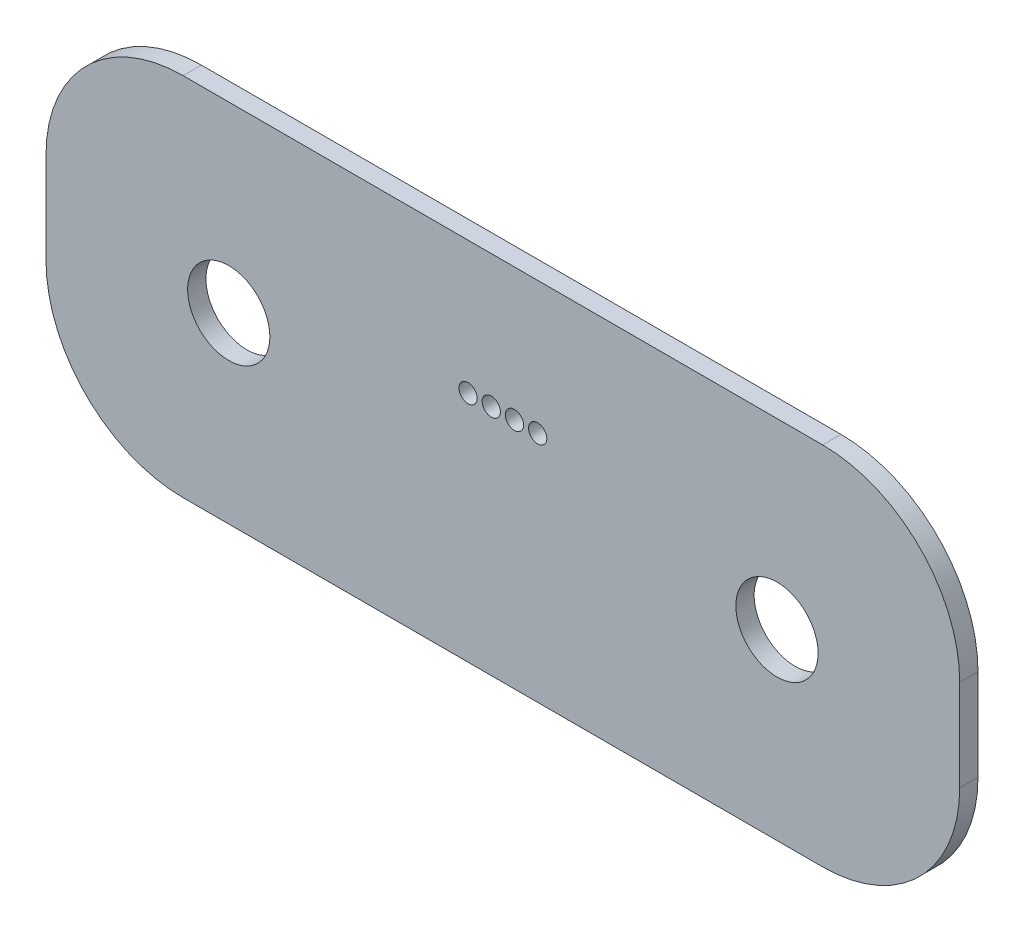
from build123d import *

# Parameters (mm, degrees)
SKETCH1_R           = 2.25
SKETCH1_R_2         = 0.5
BOSS_EXTRUDE1_DEPTH = 1


with BuildPart() as part:
    # Sketch1 → Boss-Extrude1 (new body)
    with BuildSketch(Plane.XY):
        with BuildLine():
            Line((-25, 2.5), (-25, -2.5))
            ThreePointArc((-25, -2.5), (-22.803300859, -7.803300859), (-17.5, -10))
            Line((-17.5, -10), (17.5, -10))
            ThreePointArc((17.5, -10), (22.803300859, -7.803300859), (25, -2.5))
            Line((25, -2.5), (25, 2.5))
            ThreePointArc((25, 2.5), (22.803300859, 7.803300859), (17.5, 10))
            Line((17.5, 10), (-17.5, 10))
            ThreePointArc((-17.5, 10), (-22.803300859, 7.803300859), (-25, 2.5))
        make_face()
        with Locations((-15, 0)):
            Circle(SKETCH1_R, mode=Mode.SUBTRACT)
        with Locations((15, 0)):
            Circle(SKETCH1_R, mode=Mode.SUBTRACT)
        with Locations((-1.905, 2.75)):
            Circle(SKETCH1_R_2, mode=Mode.SUBTRACT)
        with Locations((1.905, 2.75)):
            Circle(SKETCH1_R_2, mode=Mode.SUBTRACT)
        with Locations((0.635, 2.75)):
            Circle(SKETCH1_R_2, mode=Mode.SUBTRACT)
        with Locations((-0.635, 2.75)):
            Circle(SKETCH1_R_2, mode=Mode.SUBTRACT)
    extrude(amount=BOSS_EXTRUDE1_DEPTH)


solid = part.part
